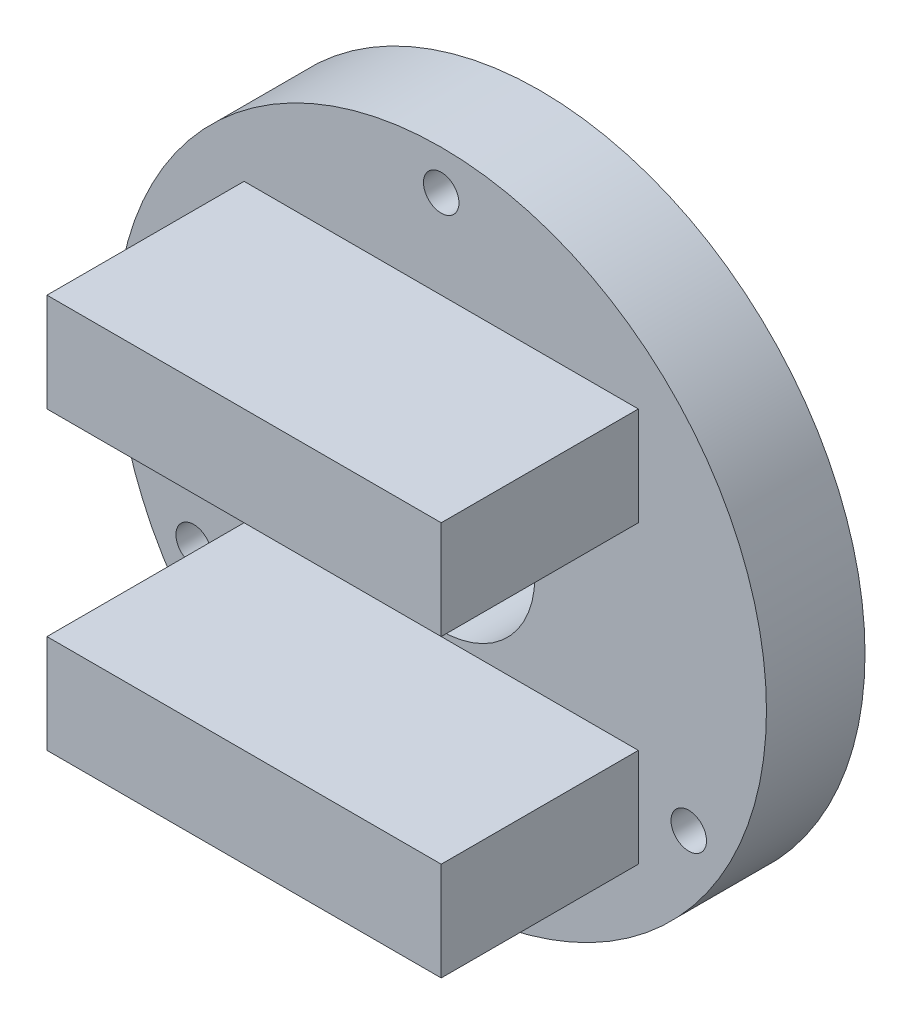
from build123d import *

# Parameters (mm, degrees)
SKETCH_1_R      = 33
SKETCH_1_R_2    = 1.8
SKETCH_1_R_3    = 9.5
EXTRUDE_1_DEPTH = 10
SKETCH_2_W      = 40
SKETCH_2_H      = 10
EXTRUDE_2_DEPTH = 20


with BuildPart() as part:
    # 草图1 → 凸台-拉伸1 (new body)
    with BuildSketch(Plane.XY):
        Circle(SKETCH_1_R)
        with Locations((0, 29)):
            Circle(SKETCH_1_R_2, mode=Mode.SUBTRACT)
        with Locations((25.11473671, -14.5)):
            Circle(SKETCH_1_R_2, mode=Mode.SUBTRACT)
        with Locations((-25.11473671, -14.5)):
            Circle(SKETCH_1_R_2, mode=Mode.SUBTRACT)
        Circle(SKETCH_1_R_3, mode=Mode.SUBTRACT)
    extrude(amount=EXTRUDE_1_DEPTH)

    # 草图2 → 凸台-拉伸2 (add)
    with BuildSketch(Plane.XY.offset(10)):
        with Locations((0, 15)):
            Rectangle(SKETCH_2_W, SKETCH_2_H)
        with Locations((0, -15)):
            Rectangle(SKETCH_2_W, SKETCH_2_H)
    extrude(amount=EXTRUDE_2_DEPTH)


solid = part.part
